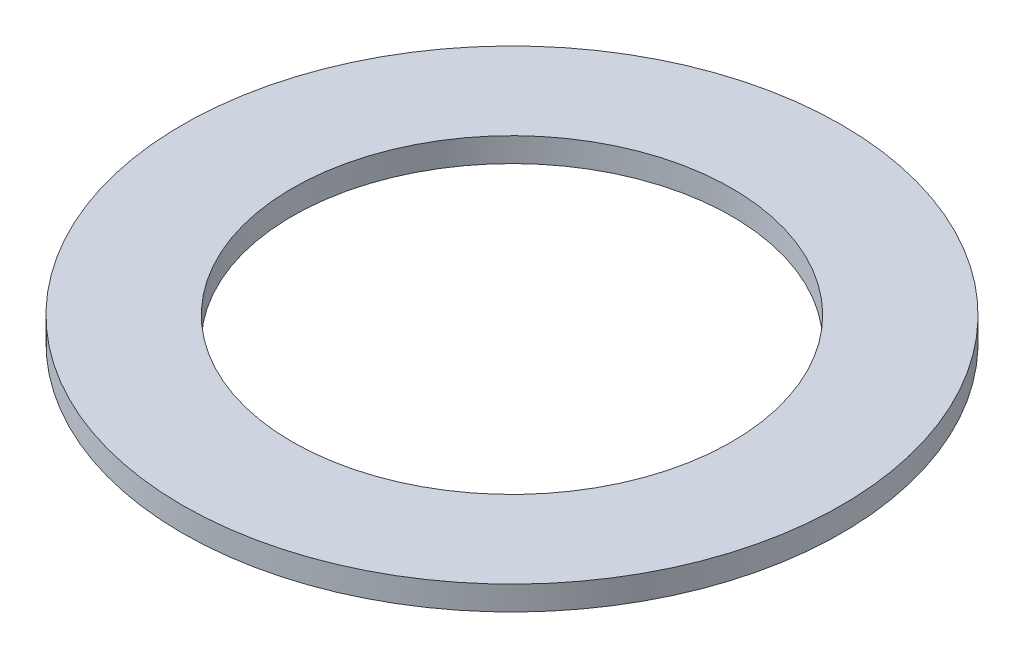
from build123d import *

# Parameters (mm, degrees)
SKETCH1_R           = 75
SKETCH1_R_2         = 50
BOSS_EXTRUDE1_DEPTH = 5.5


with BuildPart() as part:
    # Sketch1 → Boss-Extrude1 (new body)
    with BuildSketch(Plane(origin=(0, 0, 0), x_dir=(1, 0, 0), z_dir=(0, 1, 0))):
        with Locations(Location((0, 0, 0), (0, 0, 270))):
            Circle(SKETCH1_R)
        with Locations(Location((0, 0, 0), (0, 0, 270))):
            Circle(SKETCH1_R_2, mode=Mode.SUBTRACT)
    extrude(amount=BOSS_EXTRUDE1_DEPTH)


solid = part.part
